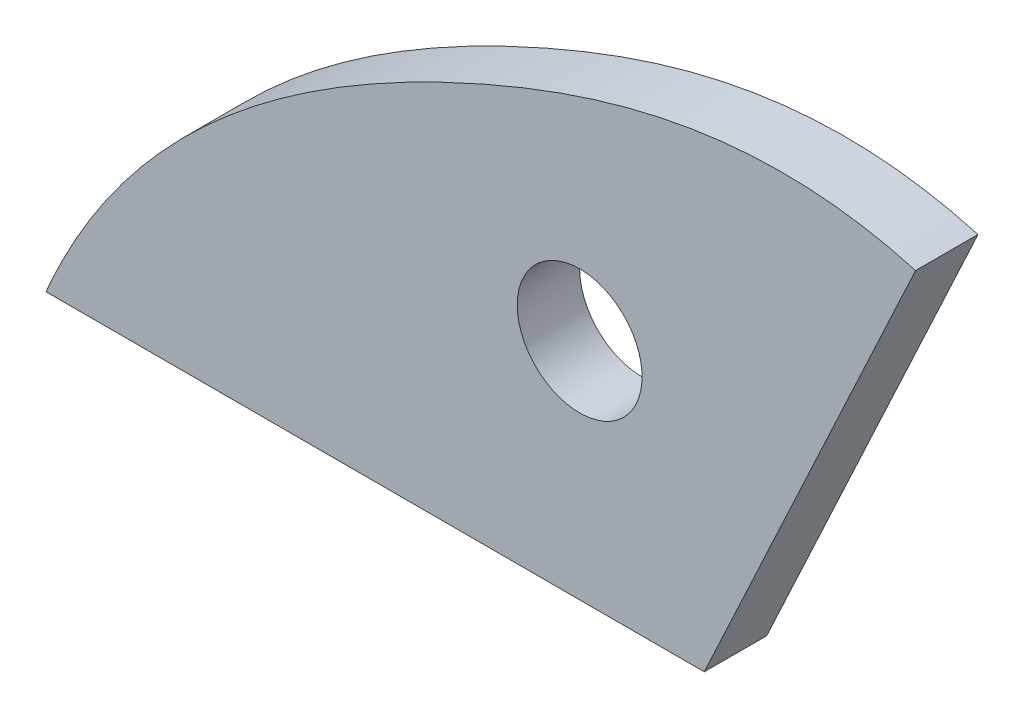
from build123d import *

# Parameters (mm, degrees)
SKETCH1_R           = 76.2
BOSS_EXTRUDE1_DEPTH = 76.2


with BuildPart() as part:
    # Sketch1 → Boss-Extrude1 (new body)
    with BuildSketch(Plane.XY):
        with BuildLine():
            Line((0, 0), (803.656, 0))
            Line((803.656, 0), (1061.640163704, 553.248824446))
            add(Edge.make_bspline(
                [(1061.640163704, 553.248824446), (874.028934524, 606.589884551), (453.429557149, 493.357749055), (100.683650407, 235.619399083), (0, 0)],
                knots=[0, 0, 0, 0, 0.433791442, 1, 1, 1, 1], degree=3))
        make_face()
        with Locations(Location((651.537493426, 273.841324369, 0), (0, 0, 180))):
            Circle(SKETCH1_R, mode=Mode.SUBTRACT)
    extrude(amount=BOSS_EXTRUDE1_DEPTH)


solid = part.part
